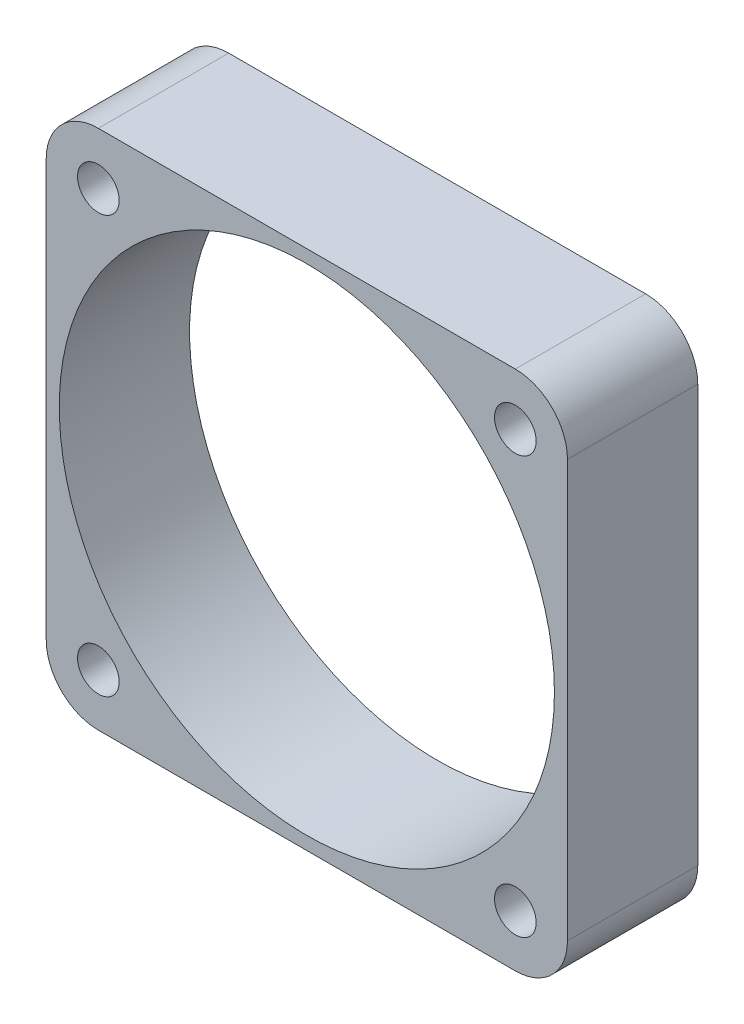
from build123d import *

# Parameters (mm, degrees)
SKETCH1_R           = 19
SKETCH1_R_2         = 1.6
BOSS_EXTRUDE1_DEPTH = 10


with BuildPart() as part:
    # Sketch1 → Boss-Extrude1 (new body)
    with BuildSketch(Plane.XY):
        with BuildLine():
            Line((-16, 20), (16, 20))
            ThreePointArc((16, 20), (18.828427125, 18.828427125), (20, 16))
            Line((20, 16), (20, -16))
            ThreePointArc((20, -16), (18.828427125, -18.828427125), (16, -20))
            Line((16, -20), (-16, -20))
            ThreePointArc((-16, -20), (-18.828427125, -18.828427125), (-20, -16))
            Line((-20, -16), (-20, 16))
            ThreePointArc((-20, 16), (-18.828427125, 18.828427125), (-16, 20))
        make_face()
        Circle(SKETCH1_R, mode=Mode.SUBTRACT)
        with Locations((-16, 16)):
            Circle(SKETCH1_R_2, mode=Mode.SUBTRACT)
        with Locations((16, 16)):
            Circle(SKETCH1_R_2, mode=Mode.SUBTRACT)
        with Locations((16, -16)):
            Circle(SKETCH1_R_2, mode=Mode.SUBTRACT)
        with Locations((-16, -16)):
            Circle(SKETCH1_R_2, mode=Mode.SUBTRACT)
    extrude(amount=BOSS_EXTRUDE1_DEPTH)


solid = part.part
